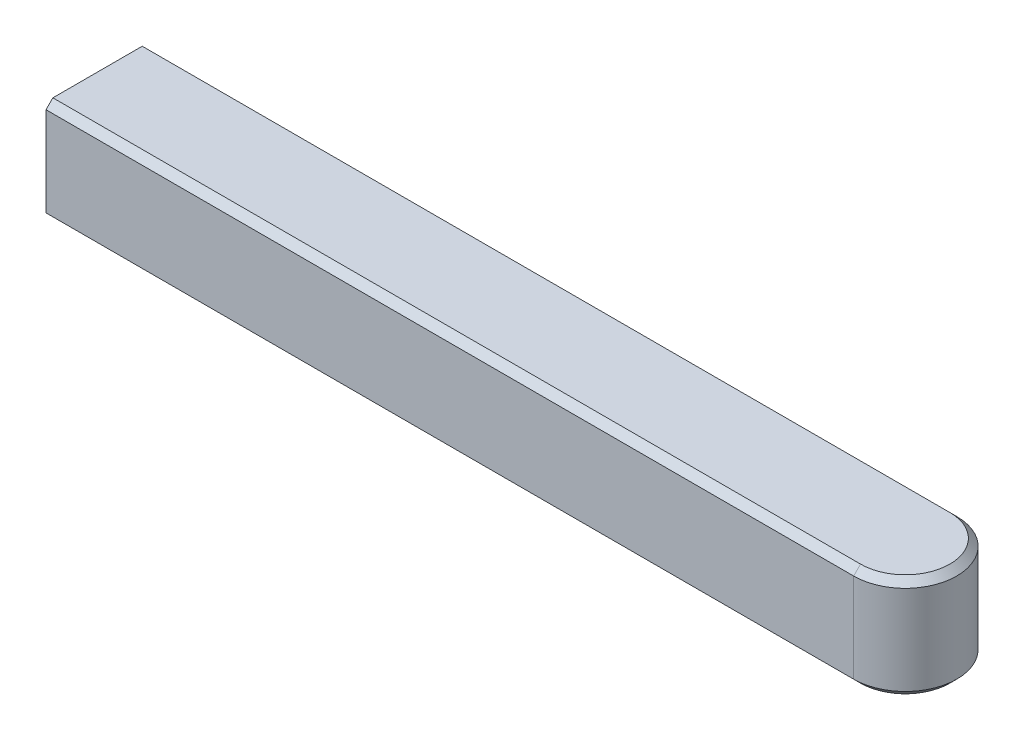
from build123d import *

# Parameters (mm, degrees)
SKETCH1_W           = 25
SKETCH1_H           = 3
BOSS_EXTRUDE1_DEPTH = 3
FILLET2_RADIUS      = 1.5
FILLET2_LENGTH      = 3
CHAMFER2_SIZE       = 0.2


with BuildPart() as part:
    # Sketch1 → Boss-Extrude1 (new body)
    with BuildSketch(Plane(origin=(0, 0, 0), x_dir=(1, 0, 0), z_dir=(0, 1, 0))):
        Rectangle(SKETCH1_W, SKETCH1_H)
    extrude(amount=BOSS_EXTRUDE1_DEPTH)

    # Fillet2: full round fillet: the end face becomes a half cylinder, R = half its width
    fillet2_face = Plane((12.5, 1.5, 0), x_dir=(0, 1, 0), z_dir=(1, 0, 0))  # on the end face: x along it, z out of the body
    fillet2_slab = fillet2_face.offset(-FILLET2_RADIUS / 2) * Box(FILLET2_LENGTH, 2 * FILLET2_RADIUS, FILLET2_RADIUS, mode=Mode.PRIVATE)  # the body's end, R deep
    fillet2_round = Plane((11, 1.5, 0), x_dir=(1, 0, 0), z_dir=(0, 1, 0)) * Cylinder(FILLET2_RADIUS, FILLET2_LENGTH, mode=Mode.PRIVATE)  # its axis R under the face
    add(fillet2_slab - fillet2_round, mode=Mode.SUBTRACT)

    # Chamfer2
    chamfer2_edges = [part.edges().sort_by_distance(p)[0] for p in [
        (-0.75, 0, -1.5),
        (-0.75, 3, -1.5),
        (12.5, 0, 0),
        (12.5, 3, 0),
        (-0.75, 0, 1.5),
        (-0.75, 3, 1.5),
    ]]
    chamfer(chamfer2_edges, length=CHAMFER2_SIZE)


solid = part.part
